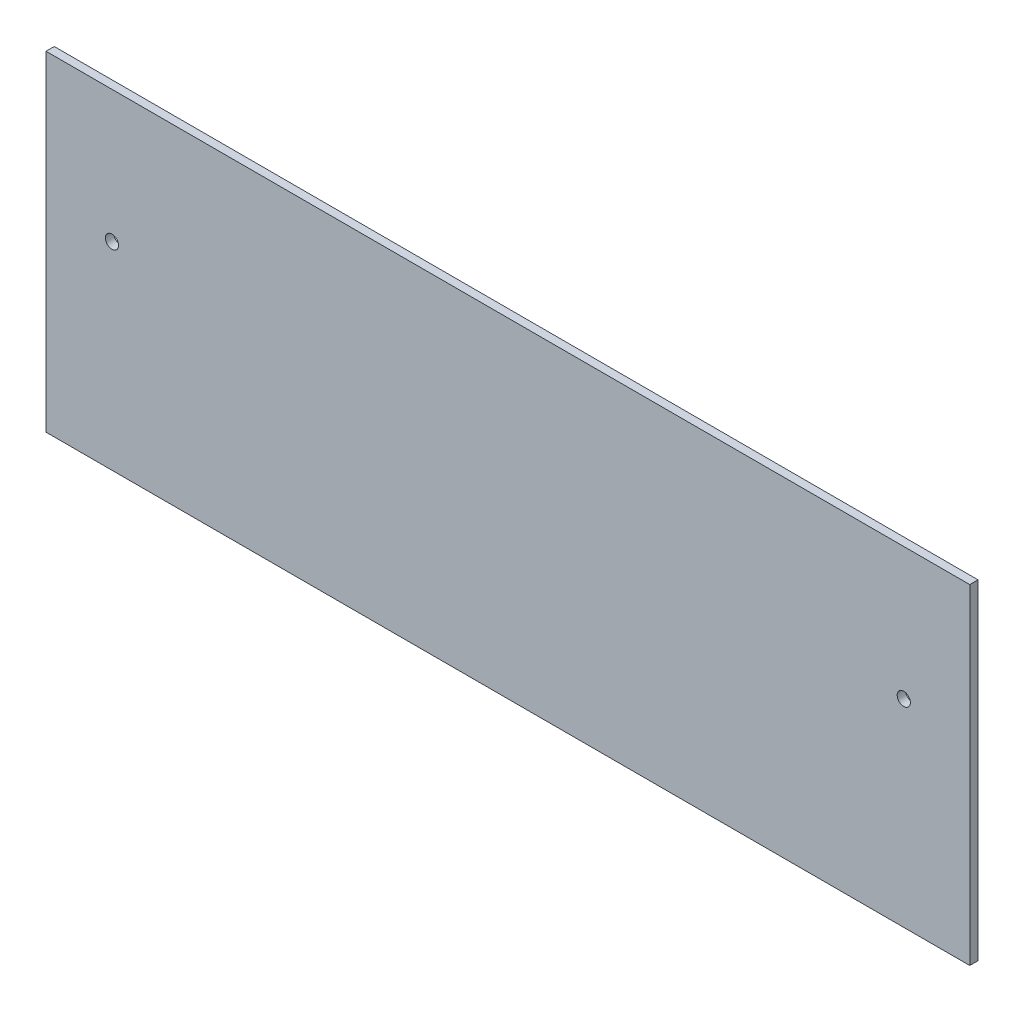
from build123d import *

# Parameters (mm, degrees)
SCHIZZO1_W                   = 280
SCHIZZO1_H                   = 100
ESTRUSIONE_ESTRUSIONE1_DEPTH = 2.5
SCHIZZO2_R                   = 2
TAGLIO_ESTRUSIONE1_DEPTH     = 10


with BuildPart() as part:
    # Schizzo1 → Estrusione-Estrusione1 (new body)
    with BuildSketch(Plane.XY):
        with Locations((140, 50)):
            Rectangle(SCHIZZO1_W, SCHIZZO1_H)
    extrude(amount=ESTRUSIONE_ESTRUSIONE1_DEPTH)

    # Schizzo2 → Taglio-Estrusione1 (cut)
    with BuildSketch(Plane(origin=(0, 0, 0), x_dir=(-1, 0, 0), z_dir=(0, 0, -1))):
        with Locations((-20, 60)):
            Circle(SCHIZZO2_R)
        with Locations((-260, 60)):
            Circle(SCHIZZO2_R)
    extrude(amount=-TAGLIO_ESTRUSIONE1_DEPTH, mode=Mode.SUBTRACT)


solid = part.part
